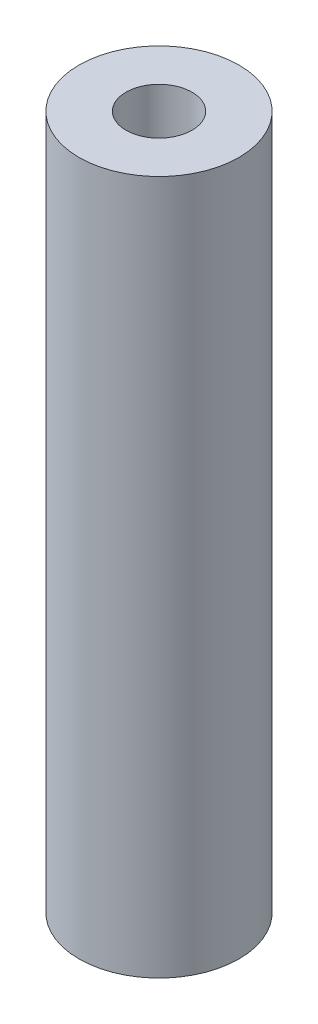
from build123d import *

# Parameters (mm, degrees)
SKETCH_1_R          = 4
EXTRUDE_1_DEPTH     = 34.7
SKETCH_2_R          = 1.65
CUT_EXTRUDE_1_DEPTH = 12
CUT_EXTRUDE_START   = -12
SKETCH_3_R          = 1.65
CUT_EXTRUDE_2_DEPTH = 12


with BuildPart() as part:
    # ｽｹｯﾁ1 → ﾎﾞｽ - 押し出し1 (new body)
    with BuildSketch(Plane(origin=(0, 0, 0), x_dir=(1, 0, 0), z_dir=(0, 1, 0))):
        with Locations(Location((0, 0, 0), (0, 0, 270))):
            Circle(SKETCH_1_R)
    extrude(amount=EXTRUDE_1_DEPTH)

    # ｽｹｯﾁ2 → ｶｯﾄ - 押し出し1 (cut)
    with BuildSketch(Plane(origin=(0, 34.7, 0), x_dir=(1, 0, 0), z_dir=(0, 1, 0))):
        with Locations(Location((0, 0, 0), (0, 0, 270))):
            Circle(SKETCH_2_R)
    extrude(amount=-CUT_EXTRUDE_1_DEPTH, mode=Mode.SUBTRACT)

    # ｽｹｯﾁ3 → ｶｯﾄ - 押し出し2 (cut)
    with BuildSketch(Plane.XZ.offset(CUT_EXTRUDE_START)):
        with Locations(Location((0, 0, 0), (0, 0, 90))):
            Circle(SKETCH_3_R)
    extrude(amount=CUT_EXTRUDE_2_DEPTH, mode=Mode.SUBTRACT)


solid = part.part
